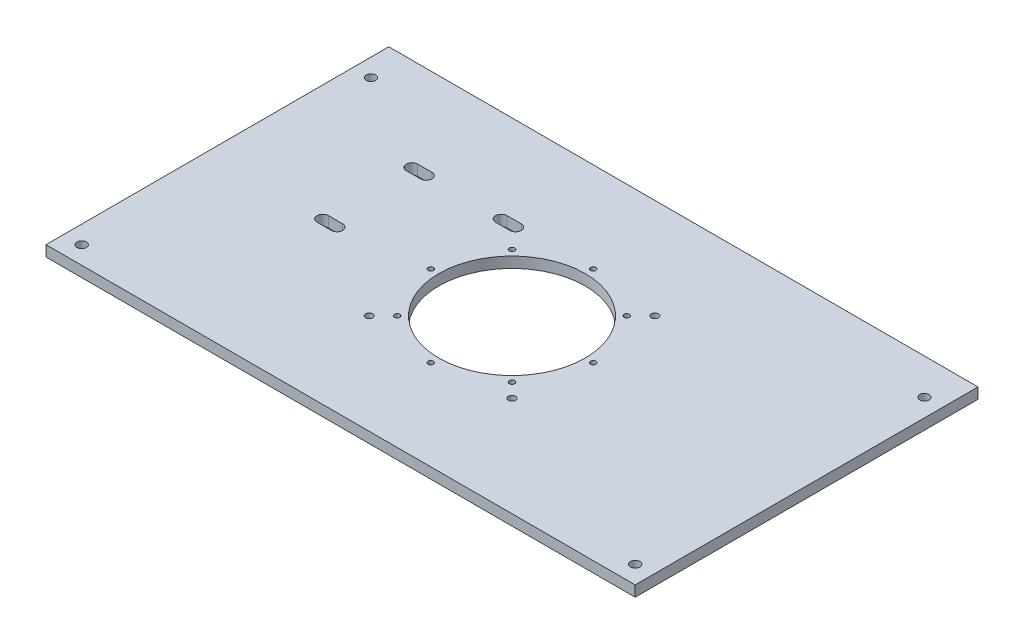
from build123d import *

# Parameters (mm, degrees)
SKETCH1_W                = 330
SKETCH1_H                = 192
BOSS_EXTRUDE1_DEPTH      = 6
CUT_EXTRUDE1_DEPTH       = 382.837661841
CUT_EXTRUDE1_DEPTH_BACK  = 382.837661841
SKETCH2_R                = 1.5
SKETCH3_R                = 41
CUT_EXTRUDE2_DEPTH       = 382.837661841
CUT_EXTRUDE5_DEPTH       = 10
SKETCH11_R               = 2
CUT_EXTRUDE6_DEPTH       = 10
M5_CLEARANCE_HOLE1_D     = 5.3
M5_CLEARANCE_HOLE1_DEPTH = 11.94
M5_CLEARANCE_HOLE1_TIP   = 1.59228064


with BuildPart() as part:
    # Sketch1 → Boss-Extrude1 (new body)
    with BuildSketch(Plane(origin=(0, 0, 0), x_dir=(1, 0, 0), z_dir=(0, 1, 0))):
        with Locations((165, 96)):
            Rectangle(SKETCH1_W, SKETCH1_H)
    extrude(amount=BOSS_EXTRUDE1_DEPTH)

    # Sketch2 → Cut-Extrude1 (cut, two sides: drawn at the far end of the back side and taken through both)
    with BuildSketch(Plane(origin=(0, 6, 0), x_dir=(1, 0, 0), z_dir=(0, 1, 0)).offset(-CUT_EXTRUDE1_DEPTH_BACK)):
        with Locations(Location((165, 141.5, 0), (0, 0, 270))):
            Circle(SKETCH2_R)
        with Locations(Location((197.173358544, 128.173358544, 0), (0, 0, 270))):
            Circle(SKETCH2_R)
        with Locations(Location((210.5, 96, 0), (0, 0, 270))):
            Circle(SKETCH2_R)
        with Locations(Location((165, 50.5, 0), (0, 0, 270))):
            Circle(SKETCH2_R)
        with Locations(Location((132.826641456, 63.826641456, 0), (0, 0, 270))):
            Circle(SKETCH2_R)
        with Locations(Location((119.5, 96, 0), (0, 0, 270))):
            Circle(SKETCH2_R)
        with Locations(Location((132.826641456, 128.173358544, 0), (0, 0, 270))):
            Circle(SKETCH2_R)
        with Locations(Location((197.173358544, 63.826641456, 0), (0, 0, 270))):
            Circle(SKETCH2_R)
    extrude(amount=CUT_EXTRUDE1_DEPTH + CUT_EXTRUDE1_DEPTH_BACK, mode=Mode.SUBTRACT)

    # Sketch3 → Cut-Extrude2 (cut, through all)
    with BuildSketch(Plane(origin=(0, 6, 0), x_dir=(1, 0, 0), z_dir=(0, 1, 0))):
        with Locations(Location((165, 96, 0), (0, 0, 270))):
            Circle(SKETCH3_R)
    extrude(amount=-CUT_EXTRUDE2_DEPTH, mode=Mode.SUBTRACT)

    # Sketch10 → Cut-Extrude5 (cut)
    with BuildSketch(Plane.XZ):
        with BuildLine():
            Line((123, -136.8), (115, -136.8))
            ThreePointArc((115, -136.8), (111.8, -140), (115, -143.2))
            Line((115, -143.2), (123, -143.2))
            ThreePointArc((123, -143.2), (126.2, -140), (123, -136.8))
        make_face()
        with BuildLine():
            Line((73, -136.8), (65, -136.8))
            ThreePointArc((65, -136.8), (61.8, -140), (65, -143.2))
            Line((65, -143.2), (73, -143.2))
            ThreePointArc((73, -143.2), (76.2, -140), (73, -136.8))
        make_face()
        with BuildLine():
            Line((73, -86.8), (65, -86.8))
            ThreePointArc((65, -86.8), (61.8, -90), (65, -93.2))
            Line((65, -93.2), (73, -93.2))
            ThreePointArc((73, -93.2), (76.2, -90), (73, -86.8))
        make_face()
    extrude(amount=-CUT_EXTRUDE5_DEPTH, mode=Mode.SUBTRACT)

    # Sketch11 → Cut-Extrude6 (cut)
    with BuildSketch(Plane.XZ):
        with Locations(Location((125, -56, 0), (0, 0, 270))):
            Circle(SKETCH11_R)
        with Locations(Location((205, -56, 0), (0, 0, 270))):
            Circle(SKETCH11_R)
        with Locations(Location((205, -136, 0), (0, 0, 270))):
            Circle(SKETCH11_R)
    extrude(amount=-CUT_EXTRUDE6_DEPTH, mode=Mode.SUBTRACT)

    # M5 Clearance Hole1
    with Locations(Plane(origin=(0, 6, 0), x_dir=(1, 0, 0), z_dir=(0, 1, 0))):
        with Locations((10, 172), (10, 10), (320, 10), (320, 172)):
            Hole(M5_CLEARANCE_HOLE1_D / 2, depth=M5_CLEARANCE_HOLE1_DEPTH)
            with Locations((0, 0, -(M5_CLEARANCE_HOLE1_DEPTH + M5_CLEARANCE_HOLE1_TIP / 2))):  # 118° drill point
                Cone(0, M5_CLEARANCE_HOLE1_D / 2, M5_CLEARANCE_HOLE1_TIP, mode=Mode.SUBTRACT)


solid = part.part
